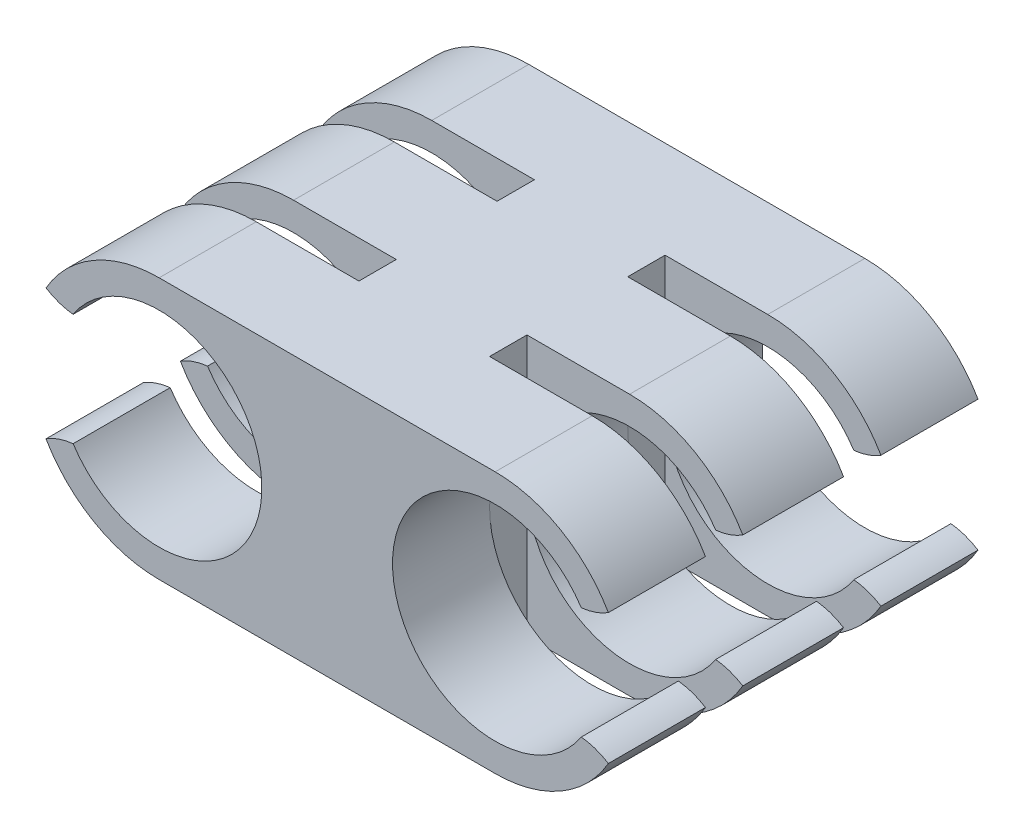
from build123d import *

# Parameters (mm, degrees)
BOSS_EXTRUDE1_DEPTH = 9.9
SKETCH4_W           = 5.781088914
SKETCH4_H           = 1
SKETCH4_W_2         = 5.781088913
CUT_EXTRUDE3_DEPTH  = 20.352504887


with BuildPart() as part:
    # Sketch1 → Boss-Extrude1 (new body)
    with BuildSketch(Plane.XY):
        with BuildLine():
            Line((3.052327113, 5.893513233), (12.052327113, 5.893513233))
            ThreePointArc((12.052327113, 5.893513233), (13.802327113, 5.424602146), (15.083416026, 4.143513233))
            add(Edge.make_bspline(
                [(14.357213227, 3.893513233), (14.754135226, 3.935799795), (15.083416026, 4.143513233)],
                knots=[0, 0, 0, 1, 1, 1], degree=2))
            ThreePointArc((14.357213227, 3.893513233), (9.302327113, 2.393513233), (14.357213227, 0.893513233))
            add(Edge.make_bspline(
                [(14.357213227, 0.893513233), (14.754135226, 0.851226671), (15.083416026, 0.643513233)],
                knots=[0, 0, 0, 1, 1, 1], degree=2))
            ThreePointArc((15.083416026, 0.643513233), (13.802327113, -0.637575681), (12.052327113, -1.106486767))
            Line((12.052327113, -1.106486767), (3.052327113, -1.106486767))
            ThreePointArc((3.052327113, -1.106486767), (1.302327113, -0.637575681), (0.021238199, 0.643513233))
            add(Edge.make_bspline(
                [(0.747440998, 0.893513233), (0.350518999, 0.851226671), (0.021238199, 0.643513233)],
                knots=[0, 0, 0, 1, 1, 1], degree=2))
            ThreePointArc((0.747440998, 0.893513233), (5.802327113, 2.393513233), (0.747440998, 3.893513233))
            add(Edge.make_bspline(
                [(0.747440998, 3.893513233), (0.350518999, 3.935799795), (0.021238199, 4.143513233)],
                knots=[0, 0, 0, 1, 1, 1], degree=2))
            ThreePointArc((0.021238199, 4.143513233), (1.302327113, 5.424602146), (3.052327113, 5.893513233))
        make_face()
    extrude(amount=BOSS_EXTRUDE1_DEPTH)

    # Sketch4 → Cut-Extrude3 (cut, through all)
    with BuildSketch(Plane(origin=(0, 5.893513233, 0), x_dir=(1, 0, 0), z_dir=(0, 1, 0))):
        with Locations((2.911782656, -3.1)):
            Rectangle(SKETCH4_W, SKETCH4_H)
        with Locations((12.192871569, -3.1)):
            Rectangle(SKETCH4_W_2, SKETCH4_H)
        with Locations((12.192871569, -6.8)):
            Rectangle(SKETCH4_W_2, SKETCH4_H)
        with Locations((2.911782656, -6.8)):
            Rectangle(SKETCH4_W, SKETCH4_H)
    extrude(amount=-CUT_EXTRUDE3_DEPTH, mode=Mode.SUBTRACT)


solid = part.part
